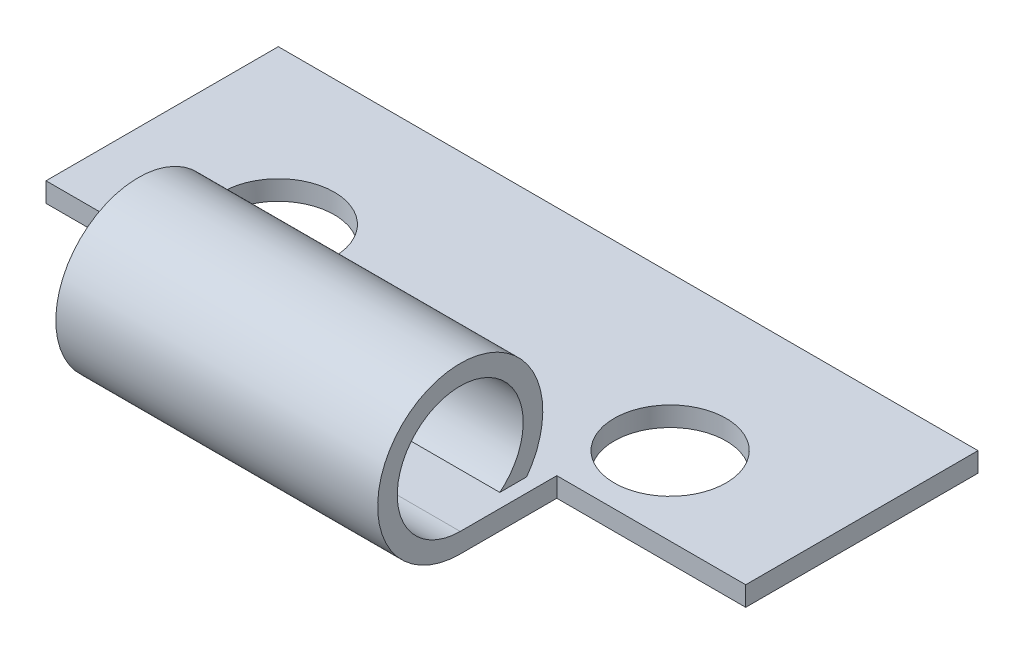
from build123d import *

# Parameters (mm, degrees)
SALIENTE_EXTRUIR1_DEPTH    = 12.5
CORTAR_EXTRUIR1_REACH      = 21.475
CROQUIS5_R                 = 2
CORTAR_EXTRUIR2_DEPTH      = 20.475369059
CORTAR_EXTRUIR2_DEPTH_BACK = 20.475369059


with BuildPart() as part:
    # Croquis4 → Saliente-Extruir1 (new, symmetric)
    with BuildSketch(Plane(origin=(0, 0, 0), x_dir=(0, 0, -1), z_dir=(1, 0, 0))):
        with BuildLine():
            Line((14, 0), (14, 0.7))
            Line((14, 0.7), (2.25, 0.7))
            ThreePointArc((2.25, 0.7), (1.5, 5.071320344), (3.664213562, 1.2))
            Line((3.664213562, 1.2), (4.624868417, 1.2))
            ThreePointArc((4.624868417, 1.2), (0.91958653, 5.582964109), (2.25, 0))
            Line((2.25, 0), (14, 0))
        make_face()
    extrude(amount=SALIENTE_EXTRUIR1_DEPTH, both=True)

    # Croquis5 → Cortar-Extruir1 (cut, up to next)
    with BuildSketch(Plane(origin=(0, 0.7, 0), x_dir=(1, 0, 0), z_dir=(0, 1, 0)), mode=Mode.PRIVATE) as cortar_extruir1_sk1:
        with Locations(Location((7, 8.5, 0), (0, 0, 270))):
            Circle(CROQUIS5_R)
    cortar_extruir1_tool1 = extrude(cortar_extruir1_sk1.sketch, amount=-CORTAR_EXTRUIR1_REACH, mode=Mode.PRIVATE) & part.part
    # Croquis5 → Cortar-Extruir1 (cut, up to next)
    with BuildSketch(Plane(origin=(0, 0.7, 0), x_dir=(1, 0, 0), z_dir=(0, 1, 0)), mode=Mode.PRIVATE) as cortar_extruir1_sk2:
        with Locations(Location((-7, 8.5, 0), (0, 0, 270))):
            Circle(CROQUIS5_R)
    cortar_extruir1_tool2 = extrude(cortar_extruir1_sk2.sketch, amount=-CORTAR_EXTRUIR1_REACH, mode=Mode.PRIVATE) & part.part
    add(cortar_extruir1_tool1.solids().sort_by_distance((7, 0.7, -8.5))[0], mode=Mode.SUBTRACT)
    add(cortar_extruir1_tool2.solids().sort_by_distance((-7, 0.7, -8.5))[0], mode=Mode.SUBTRACT)

    # Croquis6 → Cortar-Extruir2 (cut, two sides: drawn at the far end of the back side and taken through both)
    with BuildSketch(Plane(origin=(0, 0.7, 0), x_dir=(1, 0, 0), z_dir=(0, 1, 0)).offset(-CORTAR_EXTRUIR2_DEPTH_BACK)):
        Polygon((-5.75, 5.7), (-13.048594363, 5.7), (-13.048594363, -1.964735147), (14.193675093, -1.964735147), (14.193675093, 5.7), (5.75, 5.7), (5.75, -0.7), (-5.75, -0.7), align=None)
    extrude(amount=CORTAR_EXTRUIR2_DEPTH + CORTAR_EXTRUIR2_DEPTH_BACK, mode=Mode.SUBTRACT)


solid = part.part
